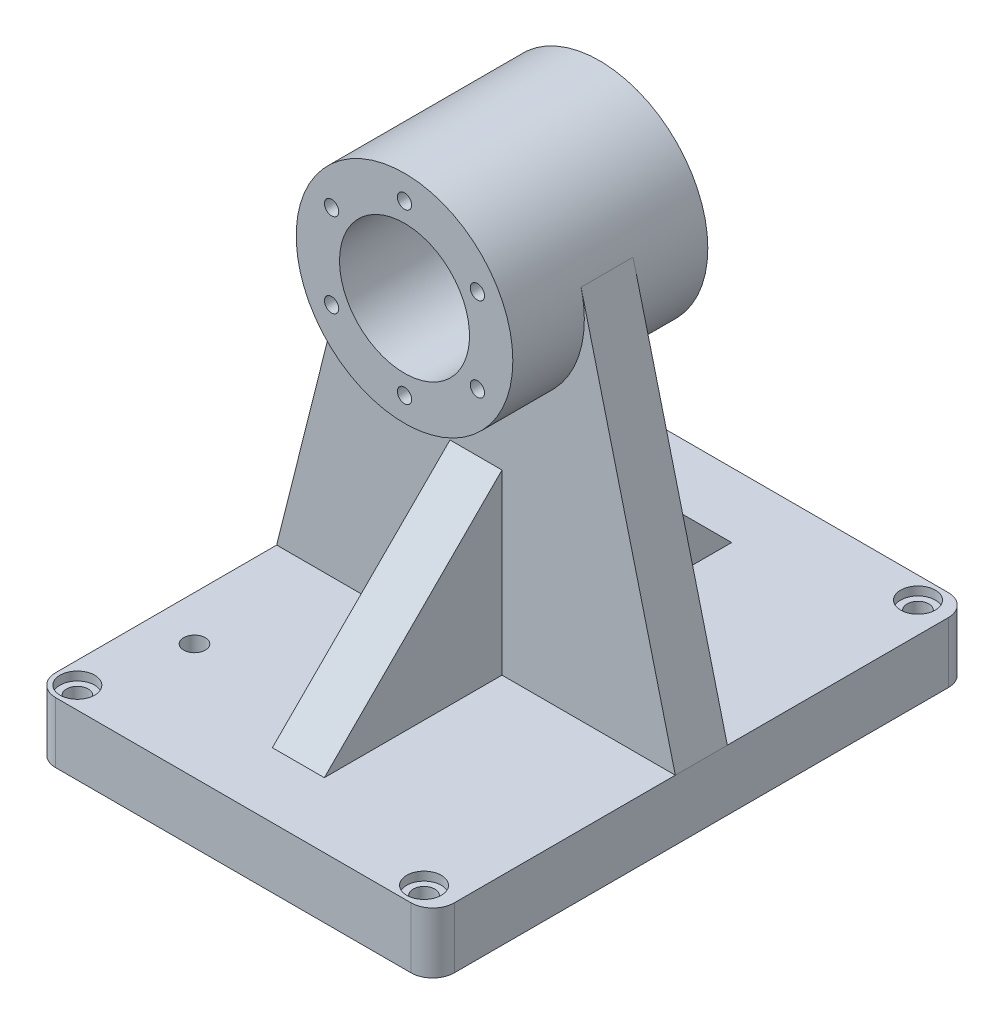
from build123d import *

# Parameters (mm, degrees)
SKETCH_1_R                   = 25
SKETCH_1_R_2                 = 15
EXTRUDE_1_DEPTH              = 22.5
SKETCH_2_W                   = 92
SKETCH_2_H                   = 14
EXTRUDE_2_DEPTH              = 62
EXTRUDE_3_DEPTH              = 6
RIB_1_REACH                  = 123.639
SKETCH_5_WALL_W              = 303.26037525
SKETCH_5_WALL_H              = 12
FILLET_1_R                   = 5
HOLE_WIZARD_M4_2_D           = 5
HOLE_WIZARD_M4_2_CBORE_D     = 8
HOLE_WIZARD_M4_2_CBORE_DEPTH = 2
PATTERN_LINEAR_1_COUNT       = 2
PATTERN_LINEAR_1_PITCH       = 80
PATTERN_LINEAR_1_COUNT_DIR2  = 2
PATTERN_LINEAR_1_PITCH_DIR2  = 114
HOLE_WIZARD_M6_1_D           = 5
PATTERN_CIRCULAR_1_COUNT     = 6


with BuildPart() as part:
    # 스케치1 → 보스-돌출1 (new, symmetric)
    with BuildSketch(Plane.XY):
        with Locations(Location((0, 0.57540869, 0), (0, 0, 180))):
            Circle(SKETCH_1_R)
        with Locations(Location((0, 0.57540869, 0), (0, 0, 180))):
            Circle(SKETCH_1_R_2, mode=Mode.SUBTRACT)
    extrude(amount=EXTRUDE_1_DEPTH, both=True)



with BuildPart() as body_2:
    # 스케치2 → 보스-돌출2 (new, symmetric)
    with BuildSketch(Plane.XY):
        with Locations((0, -87)):
            Rectangle(SKETCH_2_W, SKETCH_2_H)
    extrude(amount=EXTRUDE_2_DEPTH, both=True)


with BuildPart() as part_1:
    add(part.part)

    add(body_2.part)  # 보스-돌출3 merges body 2
    # 스케치4 → 보스-돌출3 (add, symmetric)
    with BuildSketch(Plane.XY):
        with BuildLine():
            Line((-24.247840613, 6.661641155), (-46, -80))
            Line((-46, -80), (46, -80))
            Line((46, -80), (24.247840613, 6.661641155))
            ThreePointArc((24.247840613, 6.661641155), (0, -24.42459131), (-24.247840613, 6.661641155))
        make_face()
    extrude(amount=EXTRUDE_3_DEPTH, both=True)

    # 스케치5 wall → 보강대1 (add, up to next)
    with BuildSketch(Plane(origin=(0, -59.5, 26.5), x_dir=(0, 0.707106781187, -0.707106781187), z_dir=(0, 0.707106781187, 0.707106781187)), mode=Mode.PRIVATE) as rib_1_sk1:
        Rectangle(SKETCH_5_WALL_W, SKETCH_5_WALL_H)
    rib_1_tool1 = extrude(rib_1_sk1.sketch, amount=-RIB_1_REACH, mode=Mode.PRIVATE) - part_1.part
    rib_1 = rib_1_tool1.solids().sort_by_distance((0, -59.5, 26.5))[0]
    add(rib_1)

    # 대칭 복사1: 보강대1 across plane
    add(rib_1.mirror(Plane.XY))

    # 필렛1
    fillet_1_edges = [part_1.edges().sort_by_distance(p)[0] for p in [
        (-46, -87, -62),
        (46, -87, 62),
        (-46, -87, 62),
        (46, -87, -62),
    ]]
    fillet(fillet_1_edges, radius=FILLET_1_R)

    # M4 소켓 머리 캡 나사용 카운터보어2 (through all)
    with Locations(Plane(origin=(-41, -80, 57), x_dir=(0, 0, 1), z_dir=(0, 1, 0))):
        with Locations((0, 0)):
            hole_wizard_m4_2 = CounterBoreHole(HOLE_WIZARD_M4_2_D / 2, HOLE_WIZARD_M4_2_CBORE_D / 2, HOLE_WIZARD_M4_2_CBORE_DEPTH)

    # 선형 패턴1: Hole Wizard M4 _ _ _ _ _2 2 × 2
    with Locations(*[(i * PATTERN_LINEAR_1_PITCH, 0, -j * PATTERN_LINEAR_1_PITCH_DIR2) for i in range(PATTERN_LINEAR_1_COUNT) for j in range(PATTERN_LINEAR_1_COUNT_DIR2) if (i, j) != (0, 0)]):
        add(hole_wizard_m4_2, mode=Mode.SUBTRACT)

    # M6 나사 구멍1 (through all)
    with Locations(Plane(origin=(-35.723311544, -80, 35.243458723), x_dir=(0, 0, 1), z_dir=(0, 1, 0))):
        with Locations((0, 0)):
            Hole(HOLE_WIZARD_M6_1_D / 2)

    # 스케치21 → M4 나사 구멍1 (revolve, cut)
    with BuildSketch(Plane(origin=(0, 20, 22.5), x_dir=(0, -1, 0), z_dir=(1, 0, 0))):
        Polygon((0, 0), (0, 12.491420021), (1.65, 11.5), (1.65, 0), align=None)
    hole_wizard_m4_1 = revolve(axis=Axis((0, 20, 28.85), (0, 0, -1)), mode=Mode.SUBTRACT)

    # 원형 패턴1: M4 나사 구멍1 ×6 about axis
    pattern_circular_1_axis = Axis((0, 0.57540869, 0), (0, 0, 1))
    for i in range(1, PATTERN_CIRCULAR_1_COUNT):
        add(hole_wizard_m4_1.rotate(pattern_circular_1_axis, i * 360 / PATTERN_CIRCULAR_1_COUNT), mode=Mode.SUBTRACT)

    # 대칭 복사2: M4 나사 구멍1 across plane
    add(hole_wizard_m4_1.mirror(Plane.XY), mode=Mode.SUBTRACT)

    # 대칭 복사2 copy 1 sketch → 대칭 복사2 copy 1 (revolve, cut)
    with BuildSketch(Plane(origin=(-16.822189532, 10.287704345, -22.5), x_dir=(0.8660254037844386, -0.5000000000000001, 0), z_dir=(0.5000000000000001, 0.8660254037844386, 0))):
        Polygon((0, 0), (0, -12.491420021), (1.65, -11.5), (1.65, 0), align=None)
    revolve(axis=Axis((-16.822189532, 10.287704345, -28.85), (0, 0, -1)), mode=Mode.SUBTRACT)

    # 대칭 복사2 copy 2 sketch → 대칭 복사2 copy 2 (revolve, cut)
    with BuildSketch(Plane(origin=(-16.822189532, -9.136886965, -22.5), x_dir=(0.8660254037844387, 0.4999999999999998, 0), z_dir=(-0.4999999999999998, 0.8660254037844387, 0))):
        Polygon((0, 0), (0, -12.491420021), (1.65, -11.5), (1.65, 0), align=None)
    revolve(axis=Axis((-16.822189532, -9.136886965, -28.85), (0, 0, -1)), mode=Mode.SUBTRACT)

    # 대칭 복사2 copy 3 sketch → 대칭 복사2 copy 3 (revolve, cut)
    with BuildSketch(Plane(origin=(0, -18.849182619, -22.5), x_dir=(0, 1, 0), z_dir=(-1, 0, 0))):
        Polygon((0, 0), (0, -12.491420021), (1.65, -11.5), (1.65, 0), align=None)
    revolve(axis=Axis((0, -18.849182619, -28.85), (0, 0, -1)), mode=Mode.SUBTRACT)

    # 대칭 복사2 copy 4 sketch → 대칭 복사2 copy 4 (revolve, cut)
    with BuildSketch(Plane(origin=(16.822189532, -9.136886965, -22.5), x_dir=(-0.8660254037844384, 0.5000000000000004, 0), z_dir=(-0.5000000000000004, -0.8660254037844384, 0))):
        Polygon((0, 0), (0, -12.491420021), (1.65, -11.5), (1.65, 0), align=None)
    revolve(axis=Axis((16.822189532, -9.136886965, -28.85), (0, 0, -1)), mode=Mode.SUBTRACT)

    # 대칭 복사2 copy 5 sketch → 대칭 복사2 copy 5 (revolve, cut)
    with BuildSketch(Plane(origin=(16.822189532, 10.287704345, -22.5), x_dir=(-0.8660254037844386, -0.5000000000000001, 0), z_dir=(0.5000000000000001, -0.8660254037844386, 0))):
        Polygon((0, 0), (0, -12.491420021), (1.65, -11.5), (1.65, 0), align=None)
    revolve(axis=Axis((16.822189532, 10.287704345, -28.85), (0, 0, -1)), mode=Mode.SUBTRACT)


solid = part_1.part
